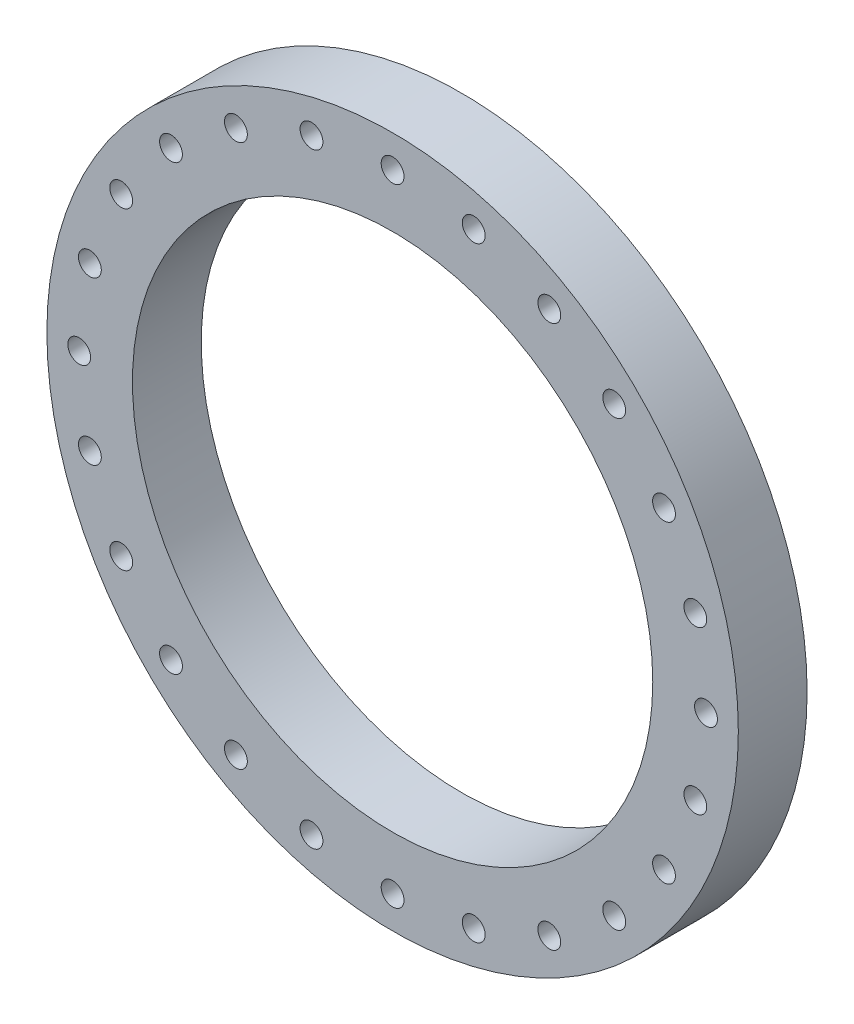
from build123d import *

# Parameters (mm, degrees)
SKETCH1_R                   = 63.8302
SKETCH1_R_2                 = 48.0314
EXTRUDE1_DEPTH              = 12.7
F_19_0_166_DIAMETER_HOLE1_D = 4.2164
CIRPATTERN1_COUNT           = 24


with BuildPart() as part:
    # Sketch1 → Extrude1 (new body)
    with BuildSketch(Plane.XY):
        Circle(SKETCH1_R)
        Circle(SKETCH1_R_2, mode=Mode.SUBTRACT)
    extrude(amount=EXTRUDE1_DEPTH)

    # #19 (0.166) Diameter Hole1 (through all)
    with Locations(Plane(origin=(0, 57.8612, 12.7), x_dir=(1, 0, 0), z_dir=(0, 0, 1))):
        with Locations((0, 0)):
            f_19_0_166_diameter_hole1 = Hole(F_19_0_166_DIAMETER_HOLE1_D / 2)

    # CirPattern1: #19 (0.166) Diameter Hole1 ×24 about axis
    cirpattern1_axis = Axis((0, 0, 0), (0, 0, 1))
    for i in range(1, CIRPATTERN1_COUNT):
        add(f_19_0_166_diameter_hole1.rotate(cirpattern1_axis, i * 360 / CIRPATTERN1_COUNT), mode=Mode.SUBTRACT)


solid = part.part
